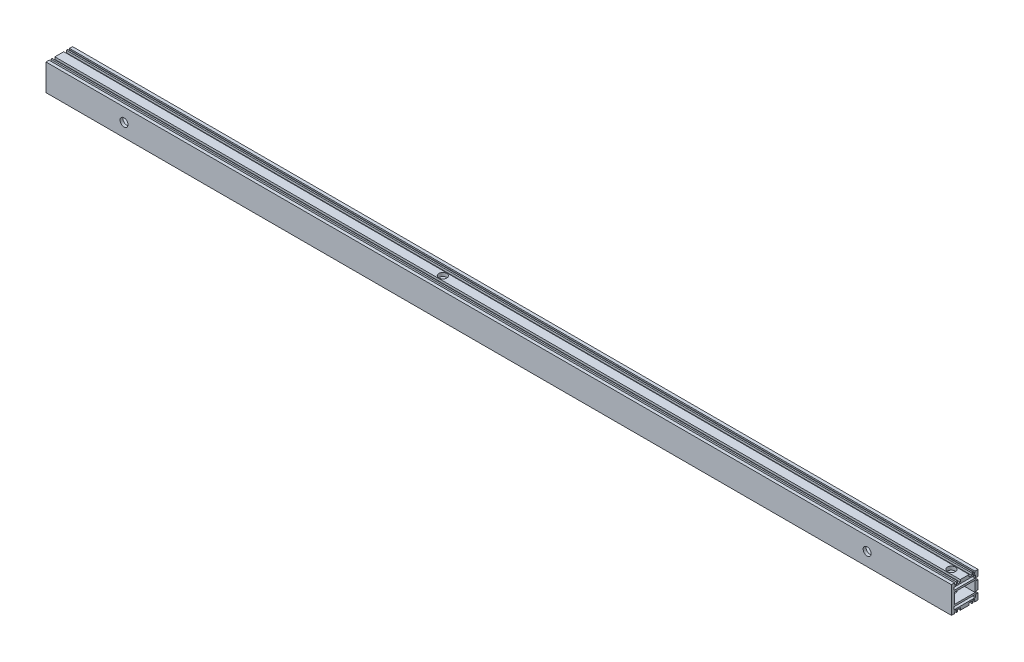
from build123d import *

# Parameters (mm, degrees)
SKETCH_1_W             = 23.5
SKETCH_1_H             = 12
EXTRUDE_1_DEPTH        = 510.5
HOLE_WIZARD_M6_1_D     = 5
HOLE_WIZARD_M6_1_DEPTH = 19
HOLE_WIZARD_M6_1_TIP   = 1.502151548
HOLE_WIZARD_M6_2_D     = 5
HOLE_WIZARD_M6_2_DEPTH = 19
HOLE_WIZARD_M6_2_TIP   = 1.502151548
HOLE_WIZARD_M6_3_D     = 5
HOLE_WIZARD_M6_3_DEPTH = 17
HOLE_WIZARD_M6_3_TIP   = 1.502151548
SKETCH_9_R             = 4.5
CUT_EXTRUDE_1_DEPTH    = 512.600674355
SKETCH_10_R            = 4.5
CUT_EXTRUDE_2_DEPTH    = 512.600674355
HOLE_WIZARD_M4_1_D     = 3.3
HOLE_WIZARD_M4_1_DEPTH = 11.5
HOLE_WIZARD_M4_1_TIP   = 0.991420021
HOLE_WIZARD_M4_2_D     = 3.3
HOLE_WIZARD_M4_2_DEPTH = 11.5
HOLE_WIZARD_M4_2_TIP   = 0.991420021


with BuildPart() as part:
    # 草图1 → 凸台-拉伸1 (new, symmetric)
    with BuildSketch(Plane(origin=(0, 0, 0), x_dir=(0, 0, -1), z_dir=(1, 0, 0))):
        Polygon((-11.5, 15), (-15, 15), (-15, -15), (-11.5, -15), (-11.5, -13.5), (-11, -13.5), (-11, -12), (-9.5, -12), (-9.5, -15), (-8, -15), (-8, -12.5), (-5, -12.5), (-5, -15), (5, -15), (5, -12.5), (8, -12.5), (8, -15), (9.5, -15), (9.5, -12), (11, -12), (11, -13.5), (11.5, -13.5), (11.5, -15), (15, -15), (15, -8), (12.5, -8), (12.5, -5), (15, -5), (15, 5), (12.5, 5), (12.5, 8), (15, 8), (15, 15), (11.5, 15), (11.5, 13.5), (11, 13.5), (11, 12), (9.5, 12), (9.5, 15), (8, 15), (8, 12.5), (5, 12.5), (5, 15), (-5, 15), (-5, 12.5), (-8, 12.5), (-8, 15), (-9.5, 15), (-9.5, 12), (-11, 12), (-11, 13.5), (-11.5, 13.5), align=None)
        with BuildLine():
            Line((12, -8.5), (12, -10.5))
            ThreePointArc((12, -10.5), (11.853553391, -10.853553391), (11.5, -11))
            Line((11.5, -11), (-11.5, -11))
            ThreePointArc((-11.5, -11), (-11.853553391, -10.853553391), (-12, -10.5))
            Line((-12, -10.5), (-12, -8.5))
            ThreePointArc((-12, -8.5), (-11.853553391, -8.146446609), (-11.5, -8))
            Line((-11.5, -8), (11.5, -8))
            ThreePointArc((11.5, -8), (11.853553391, -8.146446609), (12, -8.5))
        make_face(mode=Mode.SUBTRACT)
        Rectangle(SKETCH_1_W, SKETCH_1_H, mode=Mode.SUBTRACT)
        with BuildLine():
            ThreePointArc((-12, 10.5), (-11.853553391, 10.853553391), (-11.5, 11))
            Line((-11.5, 11), (11.5, 11))
            ThreePointArc((11.5, 11), (11.853553391, 10.853553391), (12, 10.5))
            Line((12, 10.5), (12, 8.5))
            ThreePointArc((12, 8.5), (11.853553391, 8.146446609), (11.5, 8))
            Line((11.5, 8), (-11.5, 8))
            ThreePointArc((-11.5, 8), (-11.853553391, 8.146446609), (-12, 8.5))
            Line((-12, 8.5), (-12, 10.5))
        make_face(mode=Mode.SUBTRACT)
    extrude(amount=EXTRUDE_1_DEPTH, both=True)

    # M6 螺纹孔1
    with Locations(Plane(origin=(0, -15, 0), x_dir=(-1, 0, 0), z_dir=(0, -1, 0))):
        with Locations((-460.5, 0), (-445.5, 0), (133, 0), (148, 0), (218, 0), (233, 0), (445.5, 0), (460.5, 0)):
            Hole(HOLE_WIZARD_M6_1_D / 2, depth=HOLE_WIZARD_M6_1_DEPTH)
            with Locations((0, 0, -(HOLE_WIZARD_M6_1_DEPTH + HOLE_WIZARD_M6_1_TIP / 2))):  # 118° drill point
                Cone(0, HOLE_WIZARD_M6_1_D / 2, HOLE_WIZARD_M6_1_TIP, mode=Mode.SUBTRACT)

    # M6 螺纹孔2
    with Locations(Plane(origin=(0, 0, -15), x_dir=(-1, 0, 0), z_dir=(0, 0, -1))):
        with Locations((460.5, 0), (445.5, 0), (-142.5, 0), (-157.5, 0), (-445.5, 0), (-460.5, 0), (380.5, 0)):
            Hole(HOLE_WIZARD_M6_2_D / 2, depth=HOLE_WIZARD_M6_2_DEPTH)
            with Locations((0, 0, -(HOLE_WIZARD_M6_2_DEPTH + HOLE_WIZARD_M6_2_TIP / 2))):  # 118° drill point
                Cone(0, HOLE_WIZARD_M6_2_D / 2, HOLE_WIZARD_M6_2_TIP, mode=Mode.SUBTRACT)

    # M6 螺纹孔3
    with Locations(Plane(origin=(0, -15, 0), x_dir=(-1, 0, 0), z_dir=(0, -1, 0))):
        with Locations((-262.5, 0), (-211.5, 0)):
            Hole(HOLE_WIZARD_M6_3_D / 2, depth=HOLE_WIZARD_M6_3_DEPTH)
            with Locations((0, 0, -(HOLE_WIZARD_M6_3_DEPTH + HOLE_WIZARD_M6_3_TIP / 2))):  # 118° drill point
                Cone(0, HOLE_WIZARD_M6_3_D / 2, HOLE_WIZARD_M6_3_TIP, mode=Mode.SUBTRACT)

    # 草图9 → 切除-拉伸1 (cut, through all)
    with BuildSketch(Plane.XY.offset(15)):
        with Locations((415.5, 0)):
            Circle(SKETCH_9_R)
        with Locations((-422.5, 0)):
            Circle(SKETCH_9_R)
    extrude(amount=-CUT_EXTRUDE_1_DEPTH, mode=Mode.SUBTRACT)

    # 草图10 → 切除-拉伸2 (cut, through all)
    with BuildSketch(Plane(origin=(0, 15, 0), x_dir=(1, 0, 0), z_dir=(0, 1, 0))):
        with Locations((495.5, 0)):
            Circle(SKETCH_10_R)
        with Locations((-78, 0)):
            Circle(SKETCH_10_R)
    extrude(amount=-CUT_EXTRUDE_2_DEPTH, mode=Mode.SUBTRACT)

    # M4 螺纹孔1
    with Locations(Plane(origin=(0, 0, -15), x_dir=(-1, 0, 0), z_dir=(0, 0, -1))):
        with Locations((-429.5, 0), (-401.5, 0)):
            Hole(HOLE_WIZARD_M4_1_D / 2, depth=HOLE_WIZARD_M4_1_DEPTH)
            with Locations((0, 0, -(HOLE_WIZARD_M4_1_DEPTH + HOLE_WIZARD_M4_1_TIP / 2))):  # 118° drill point
                Cone(0, HOLE_WIZARD_M4_1_D / 2, HOLE_WIZARD_M4_1_TIP, mode=Mode.SUBTRACT)

    # M4 螺纹孔2
    with Locations(Plane(origin=(0, 0, -15), x_dir=(-1, 0, 0), z_dir=(0, 0, -1))):
        with Locations((-343.5, 0)):
            Hole(HOLE_WIZARD_M4_2_D / 2, depth=HOLE_WIZARD_M4_2_DEPTH)
            with Locations((0, 0, -(HOLE_WIZARD_M4_2_DEPTH + HOLE_WIZARD_M4_2_TIP / 2))):  # 118° drill point
                Cone(0, HOLE_WIZARD_M4_2_D / 2, HOLE_WIZARD_M4_2_TIP, mode=Mode.SUBTRACT)


solid = part.part
